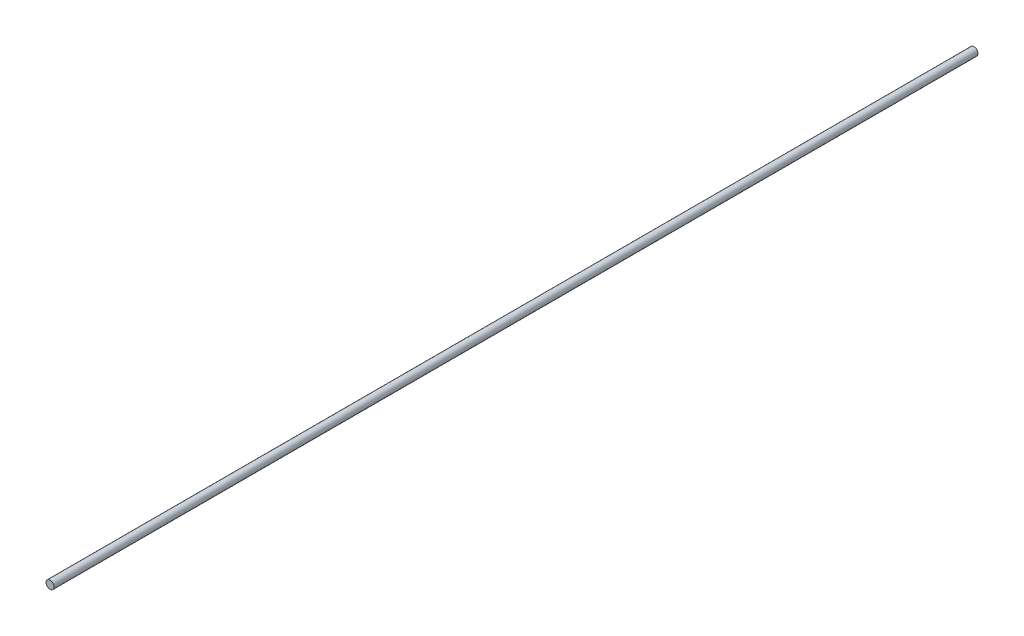
from build123d import *

# Parameters (mm, degrees)
SKETCH1_R           = 7.9375
BOSS_EXTRUDE1_DEPTH = 914.4


with BuildPart() as part:
    # Sketch1 → Boss-Extrude1 (new, symmetric)
    with BuildSketch(Plane.XY):
        Circle(SKETCH1_R)
    extrude(amount=BOSS_EXTRUDE1_DEPTH, both=True)


solid = part.part
